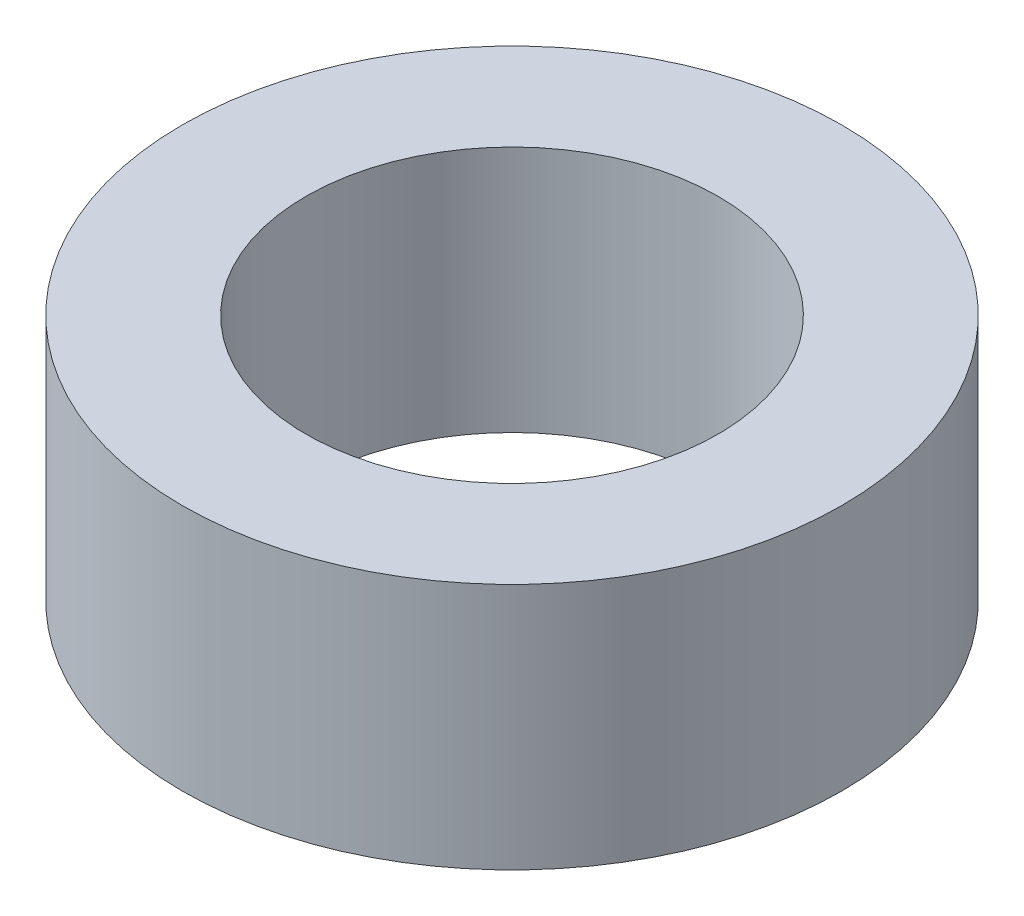
from build123d import *

# Parameters (mm, degrees)
SKETCH1_R           = 12.7
SKETCH1_R_2         = 7.9375
BOSS_EXTRUDE1_DEPTH = 9.525


with BuildPart() as part:
    # Sketch1 → Boss-Extrude1 (new body)
    with BuildSketch(Plane(origin=(0, 0, 0), x_dir=(1, 0, 0), z_dir=(0, 1, 0))):
        with Locations(Location((0, 0, 0), (0, 0, 90))):
            Circle(SKETCH1_R)
        with Locations(Location((0, 0, 0), (0, 0, 90))):
            Circle(SKETCH1_R_2, mode=Mode.SUBTRACT)
    extrude(amount=BOSS_EXTRUDE1_DEPTH)


solid = part.part
